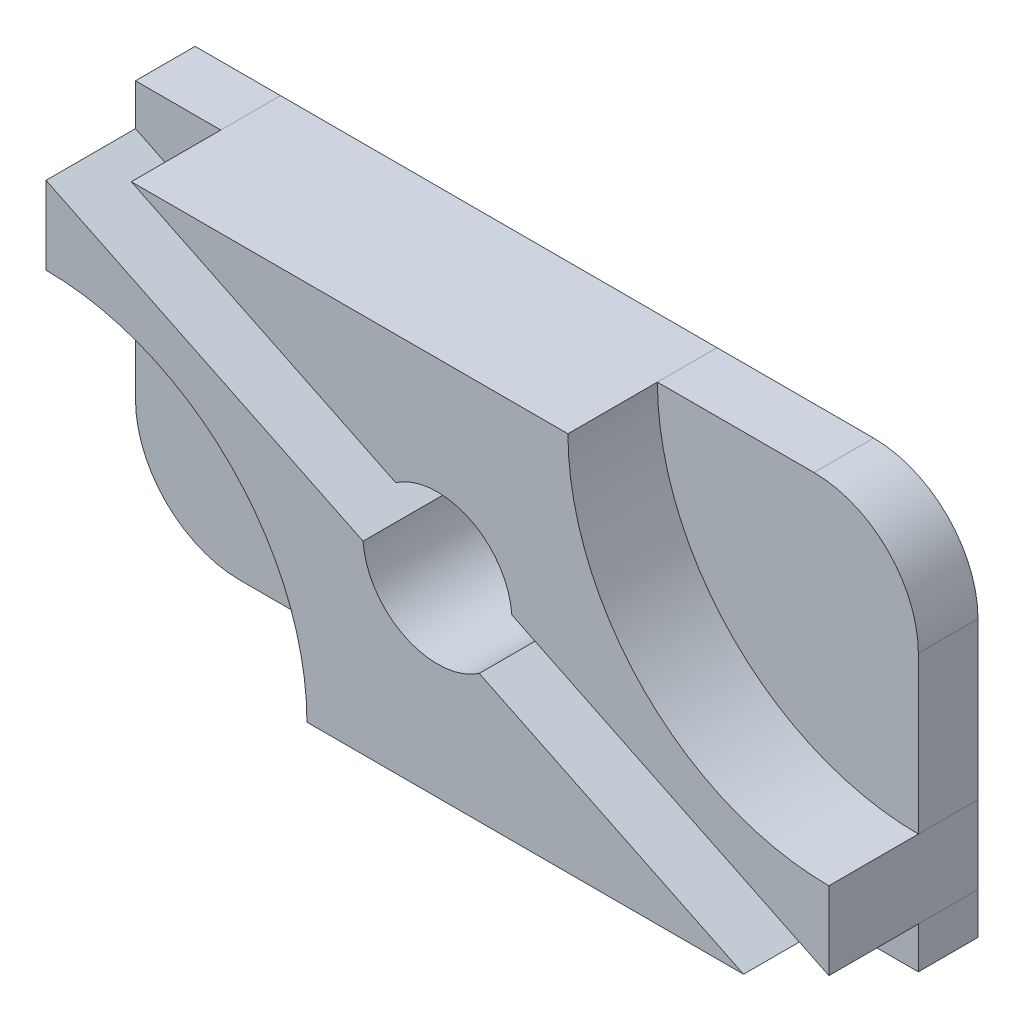
from build123d import *

# Parameters (mm, degrees)
BOSS_EXTRUDE1_DEPTH   = 20
BOSS_EXTRUDE1_2_DEPTH = 20
BOSS_EXTRUDE2_DEPTH   = 8


with BuildPart() as part:
    # Sketch1 → Boss-Extrude1 (new body)
    with BuildSketch(Plane.XY):
        with BuildLine():
            Line((17.5, 25.5), (-41.055837377, 25.5))
            Line((-41.055837377, 25.5), (-5.605449349, 8.2812401))
            ThreePointArc((-5.605449349, 8.2812401), (4.369039627, 8.995081586), (9.974488976, 0.713841485))
            Line((9.974488976, 0.713841485), (52.5, -19.941406726))
            Line((52.5, -19.941406726), (52.5, -9.5))
            ThreePointArc((52.5, -9.5), (27.751262658, 0.751262658), (17.5, 25.5))
        make_face()
    extrude(amount=BOSS_EXTRUDE1_DEPTH)


with BuildPart() as body_2:
    # Sketch1 → Boss-Extrude1 2 (new body)
    with BuildSketch(Plane.XY):
        with BuildLine():
            ThreePointArc((5.605449349, -8.2812401), (-4.369039627, -8.995081586), (-9.974488976, -0.713841485))
            Line((-9.974488976, -0.713841485), (-52.5, 19.941406726))
            Line((-52.5, 19.941406726), (-52.5, 9.5))
            ThreePointArc((-52.5, 9.5), (-27.751262658, -0.751262658), (-17.5, -25.5))
            Line((-17.5, -25.5), (41.055837377, -25.5))
            Line((41.055837377, -25.5), (5.605449349, -8.2812401))
        make_face()
    extrude(amount=BOSS_EXTRUDE1_2_DEPTH)

    # Sketch1<3> → Boss-Extrude2 (add)
    with BuildSketch(Plane.XY):
        with BuildLine():
            Line((-5.605449349, 8.2812401), (-41.055837377, 25.5))
            Line((-41.055837377, 25.5), (-52.5, 25.5))
            Line((-52.5, 25.5), (-52.5, 19.941406726))
            Line((-52.5, 19.941406726), (-9.974488976, -0.713841485))
            ThreePointArc((-9.974488976, -0.713841485), (-8.995081586, 4.369039627), (-5.605449349, 8.2812401))
        make_face()
        with BuildLine():
            Line((38.5, 25.5), (17.5, 25.5))
            ThreePointArc((17.5, 25.5), (27.751262658, 0.751262658), (52.5, -9.5))
            Line((52.5, -9.5), (52.5, 11.5))
            ThreePointArc((52.5, 11.5), (48.399494937, 21.399494937), (38.5, 25.5))
        make_face()
        with BuildLine():
            Line((52.5, -19.941406726), (9.974488976, 0.713841485))
            ThreePointArc((9.974488976, 0.713841485), (8.995081586, -4.369039627), (5.605449349, -8.2812401))
            Line((5.605449349, -8.2812401), (41.055837377, -25.5))
            Line((41.055837377, -25.5), (52.5, -25.5))
            Line((52.5, -25.5), (52.5, -19.941406726))
        make_face()
        with BuildLine():
            ThreePointArc((-17.5, -25.5), (-27.751262658, -0.751262658), (-52.5, 9.5))
            Line((-52.5, 9.5), (-52.5, -11.5))
            ThreePointArc((-52.5, -11.5), (-48.399494937, -21.399494937), (-38.5, -25.5))
            Line((-38.5, -25.5), (-17.5, -25.5))
        make_face()
    extrude(amount=BOSS_EXTRUDE2_DEPTH)


with BuildPart() as boss_extrude2_piece_1:
    # of the separate pieces the step leaves, piece 1, a body of its own (boss_extrude2_pieces)
    add(body_2.part.solids().sort_by_distance((5.605449349, -8.2812401, 8))[0])


with BuildPart() as boss_extrude2_piece_2:
    # of the separate pieces the step leaves, piece 2, a body of its own (boss_extrude2_pieces)
    add(body_2.part.solids().sort_by_distance((52.5, -9.5, 0))[0])


solid = Compound([part.part, boss_extrude2_piece_1.part, boss_extrude2_piece_2.part])
